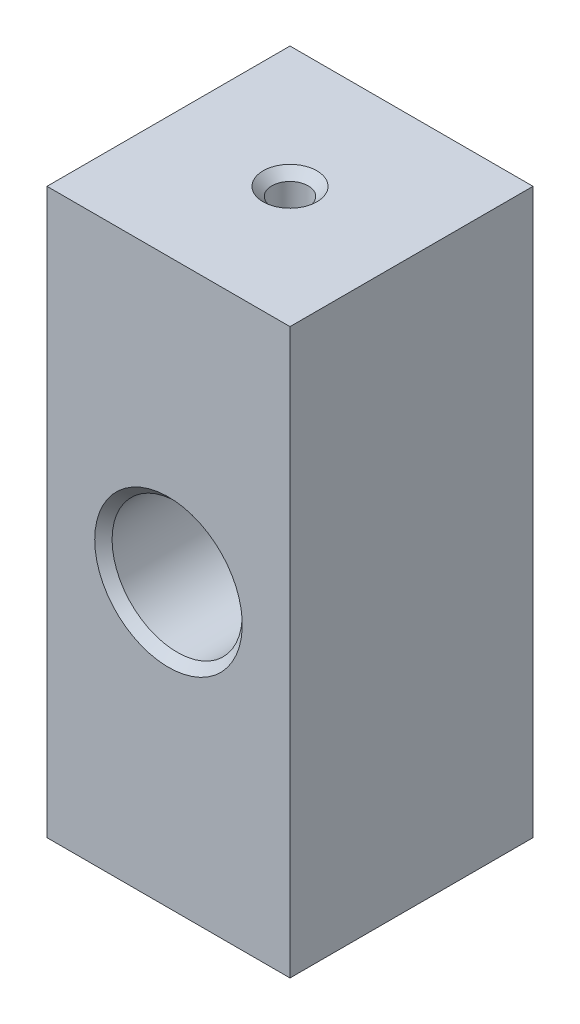
from build123d import *

# Parameters (mm, degrees)
SKETCH1_W             = 28
SKETCH1_H             = 65
SKETCH1_R             = 7.5
BOSS_EXTRUDE1_DEPTH   = 28
M5_TAPPED_HOLE3_D     = 4.2
M5_TAPPED_HOLE3_DEPTH = 18.7381927
M5_TAPPED_HOLE3_TIP   = 1.2618073
M5_TAPPED_HOLE4_D     = 4.2
M5_TAPPED_HOLE4_DEPTH = 18.7381927
M5_TAPPED_HOLE4_TIP   = 1.2618073
CHAMFER1_SIZE         = 1


with BuildPart() as part:
    # Sketch1 → Boss-Extrude1 (new body)
    with BuildSketch(Plane.XY):
        with Locations((14, 32.5)):
            Rectangle(SKETCH1_W, SKETCH1_H)
        with Locations((14, 32.5)):
            Circle(SKETCH1_R, mode=Mode.SUBTRACT)
    extrude(amount=BOSS_EXTRUDE1_DEPTH)

    # M5 Tapped Hole3
    with Locations(Plane(origin=(0, 0, 0), x_dir=(-1, 0, 0), z_dir=(0, -1, 0))):
        with Locations((-14, -11)):
            Hole(M5_TAPPED_HOLE3_D / 2, depth=M5_TAPPED_HOLE3_DEPTH)
            with Locations((0, 0, -(M5_TAPPED_HOLE3_DEPTH + M5_TAPPED_HOLE3_TIP / 2))):  # 118° drill point
                Cone(0, M5_TAPPED_HOLE3_D / 2, M5_TAPPED_HOLE3_TIP, mode=Mode.SUBTRACT)

    # M5 Tapped Hole4
    with Locations(Plane(origin=(0, 65, 0), x_dir=(1, 0, 0), z_dir=(0, 1, 0))):
        with Locations((14, -14)):
            Hole(M5_TAPPED_HOLE4_D / 2, depth=M5_TAPPED_HOLE4_DEPTH)
            with Locations((0, 0, -(M5_TAPPED_HOLE4_DEPTH + M5_TAPPED_HOLE4_TIP / 2))):  # 118° drill point
                Cone(0, M5_TAPPED_HOLE4_D / 2, M5_TAPPED_HOLE4_TIP, mode=Mode.SUBTRACT)

    # Chamfer1
    chamfer1_edges = [part.edges().sort_by_distance(p)[0] for p in [
        (6.5, 32.5, 0),
        (6.5, 32.5, 28),
        (11.9, 0, 11),
        (16.1, 65, 14),
    ]]
    chamfer(chamfer1_edges, length=CHAMFER1_SIZE)


solid = part.part
